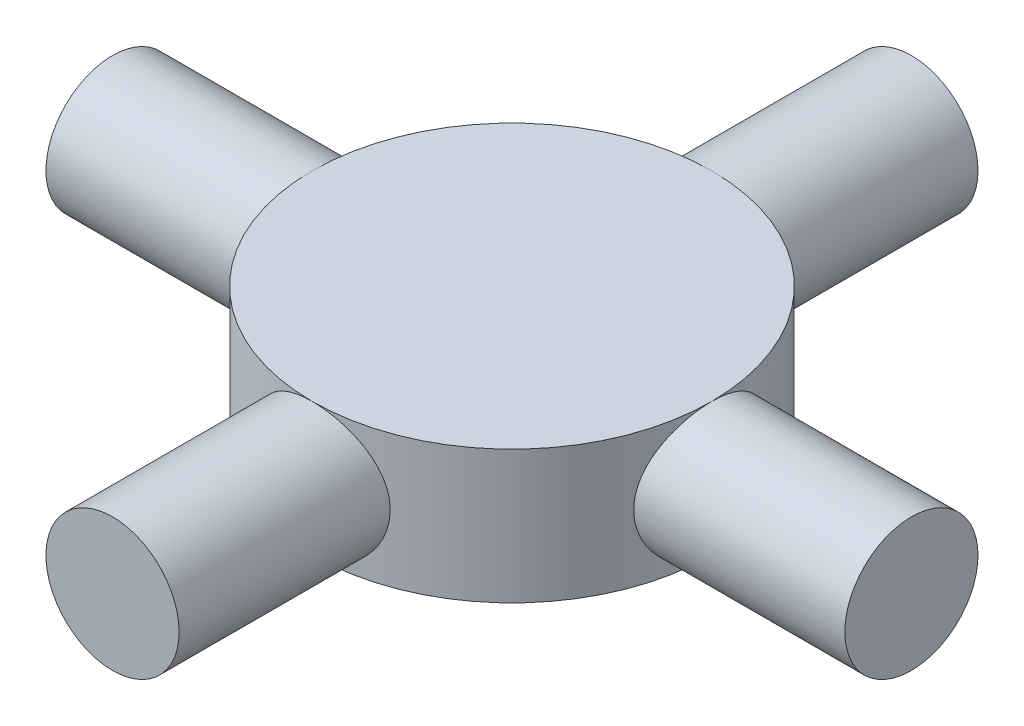
from build123d import *

# Parameters (mm, degrees)
NORTH_SOUTH_SKETCH_R              = 5
NORTH_SOUTH_EXTRUDE_DEPTH         = 60
EAST_WEST_EXTRUDE_DEPTH           = 30
EAST_WEST_EXTRUDE_DEPTH_BACK      = 30
EAST_WEST_SKETCH_R                = 5
CENTER_SUPPORT_EXTRUDE_DEPTH      = 5
CENTER_SUPPORT_EXTRUDE_DEPTH_BACK = 5
CENTER_SUPPORT_SKETCH_R           = 15


with BuildPart() as part:
    # North-South Sketch → North-South Extrude (new body)
    with BuildSketch(Plane.XY):
        Circle(NORTH_SOUTH_SKETCH_R)
    extrude(amount=NORTH_SOUTH_EXTRUDE_DEPTH)

    # East-West Sketch → East-West Extrude (add, two sides: drawn at the far end of the back side and taken through both)
    with BuildSketch(Plane(origin=(0, 0, 0), x_dir=(0, 0, -1), z_dir=(1, 0, 0)).offset(-EAST_WEST_EXTRUDE_DEPTH_BACK)):
        with Locations((-30, 0)):
            Circle(EAST_WEST_SKETCH_R)
    extrude(amount=EAST_WEST_EXTRUDE_DEPTH + EAST_WEST_EXTRUDE_DEPTH_BACK)

    # Center Support Sketch → Center Support Extrude (add, two sides: drawn at the far end of the back side and taken through both)
    with BuildSketch(Plane(origin=(0, 0, 0), x_dir=(1, 0, 0), z_dir=(0, 1, 0)).offset(-CENTER_SUPPORT_EXTRUDE_DEPTH_BACK)):
        with Locations((0, -30)):
            Circle(CENTER_SUPPORT_SKETCH_R)
    extrude(amount=CENTER_SUPPORT_EXTRUDE_DEPTH + CENTER_SUPPORT_EXTRUDE_DEPTH_BACK)


solid = part.part
